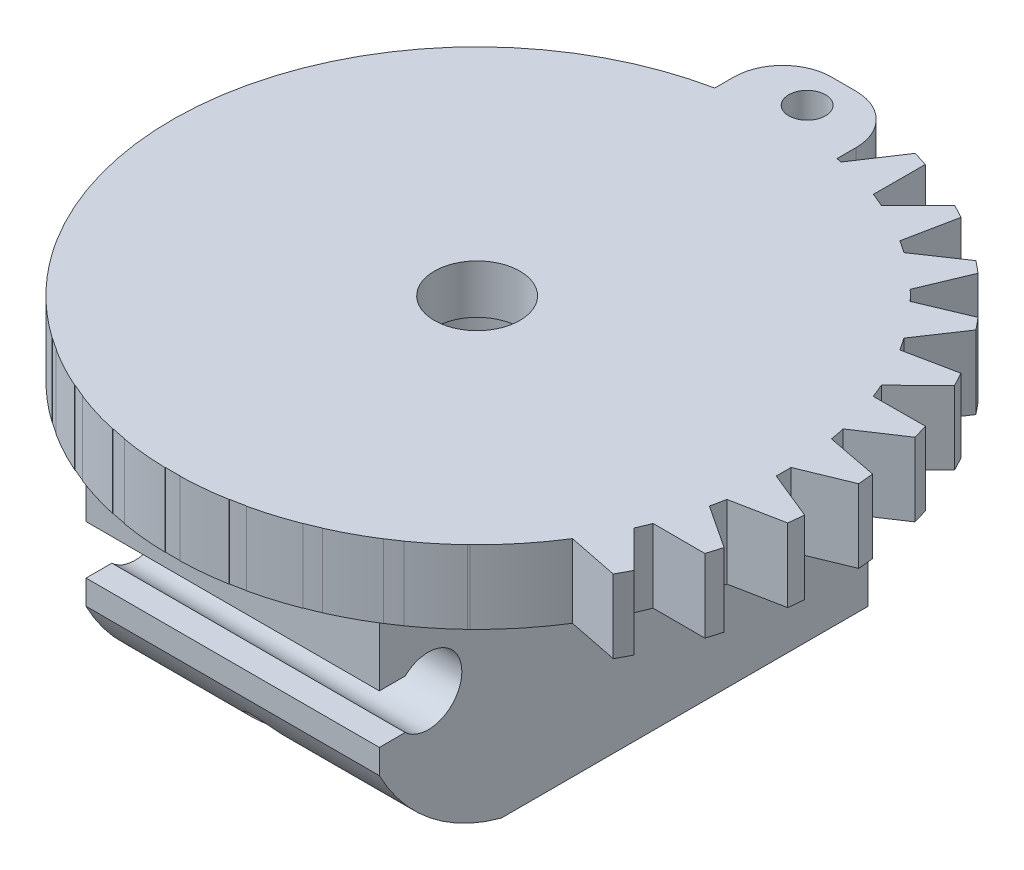
from build123d import *

# Parameters (mm, degrees)
SKETCH1_R                = 5.5
BOSS_EXTRUDE1_DEPTH      = 7
SKETCH2_R                = 3
CUT_EXTRUDE1_DEPTH       = 5
SKETCH3_R                = 10.5
BOSS_EXTRUDE2_DEPTH      = 3
BOSS_EXTRUDE3_DEPTH      = 3
SKETCH6_W                = 12
SKETCH6_H                = 20
BOSS_EXTRUDE4_DEPTH      = 10
CUT_EXTRUDE3_DEPTH       = 29.247125691
CUT_EXTRUDE3_DEPTH_BACK  = 29.247125691
CUT_EXTRUDE4_DEPTH       = 29.247125691
CUT_EXTRUDE4_DEPTH_BACK  = 29.247125691
CUT_EXTRUDE6_DEPTH       = 32.215381773
CUT_EXTRUDE6_DEPTH_BACK  = 32.215381773
SKETCH10_R               = 0.75
CUT_EXTRUDE9_DEPTH       = 10
SKETCH14_R               = 0.75
BOSS_EXTRUDE5_DEPTH      = 3
CUT_EXTRUDE10_DEPTH      = 29.881941521
CUT_EXTRUDE10_DEPTH_BACK = 7
SKETCH15_R               = 7.212432164
SKETCH16_R               = 3
SKETCH16_R_2             = 1.5
BOSS_EXTRUDE6_DEPTH      = 3
CUT_EXTRUDE2_DEPTH       = 24.112043268
CUT_EXTRUDE2_DEPTH_BACK  = 24.112043268
SKETCH5_R                = 3
BOSS_EXTRUDE7_START      = -2
SKETCH17_R               = 3
SKETCH17_R_2             = 1.75
BOSS_EXTRUDE7_DEPTH      = 2
SCALE1_SCALE             = 1.02


with BuildPart() as part:
    # Sketch1 → Boss-Extrude1 (new body)
    with BuildSketch(Plane(origin=(0, 0, 0), x_dir=(1, 0, 0), z_dir=(0, 1, 0))):
        with Locations(Location((0, 0, 0), (0, 0, 270))):
            Circle(SKETCH1_R)
    extrude(amount=BOSS_EXTRUDE1_DEPTH)

    # Sketch2 → Cut-Extrude1 (cut)
    with BuildSketch(Plane(origin=(0, 7, 0), x_dir=(1, 0, 0), z_dir=(0, 1, 0))):
        with Locations(Location((0, 0, 0), (0, 0, 270))):
            Circle(SKETCH2_R)
    extrude(amount=-CUT_EXTRUDE1_DEPTH, mode=Mode.SUBTRACT)

    # Sketch3 → Boss-Extrude2 (add)
    with BuildSketch(Plane.XZ):
        with Locations(Location((0, 0, 0), (0, 0, 270))):
            Circle(SKETCH3_R)
    extrude(amount=BOSS_EXTRUDE2_DEPTH)



with BuildPart() as body_2:
    # Sketch4 → Boss-Extrude3 (new body)
    with BuildSketch(Plane.XZ.offset(3)):
        with BuildLine():
            Line((2.736209331, 12.158039162), (3.910472421, 13.924200371))
            ThreePointArc((3.910472421, 13.924200371), (4.214262083, 13.835647145), (4.516047029, 13.740485809))
            Line((4.516047029, 13.740485809), (4.504601886, 11.622094636))
            ThreePointArc((4.504601886, 11.622094636), (4.785412065, 11.509822362), (5.063423964, 11.390789577))
            Line((5.063423964, 11.390789577), (6.559684877, 12.893927129))
            ThreePointArc((6.559684877, 12.893927129), (6.840361429, 12.747809005), (7.117782605, 12.595600846))
            Line((7.117782605, 12.595600846), (6.693279762, 10.520146802))
            ThreePointArc((6.693279762, 10.520146802), (6.946791018, 10.35524846), (7.196238852, 10.184265425))
            Line((7.196238852, 10.184265425), (8.95699712, 11.366614588))
            ThreePointArc((8.95699712, 11.366614588), (9.203774319, 11.168546804), (9.446170586, 10.965141094))
            Line((9.446170586, 10.965141094), (8.624923448, 9.012382714))
            ThreePointArc((8.624923448, 9.012382714), (8.841393486, 8.801195255), (9.052691114, 8.584832753))
            Line((9.052691114, 8.584832753), (11.010281785, 9.400956511))
            ThreePointArc((11.010281785, 9.400956511), (11.213676121, 9.158550701), (11.411732327, 8.911764209))
            Line((11.411732327, 8.911764209), (10.225300961, 7.156744902))
            ThreePointArc((10.225300961, 7.156744902), (10.396410958, 6.907384142), (10.561438332, 6.653956862))
            Line((10.561438332, 6.653956862), (12.640632293, 7.072492036))
            ThreePointArc((12.640632293, 7.072492036), (12.792827437, 6.795063719), (12.938932393, 6.514380312))
            Line((12.938932393, 6.514380312), (11.432910691, 5.024544486))
            ThreePointArc((11.432910691, 5.024544486), (11.552084986, 4.746593218), (11.664500196, 4.465840229))
            Line((11.664500196, 4.465840229), (13.78539519, 4.470702748))
            ThreePointArc((13.78539519, 4.470702748), (13.880542367, 4.168913338), (13.96908134, 3.865119521))
            Line((13.96908134, 3.865119521), (12.201344873, 2.697720732))
            ThreePointArc((12.201344873, 2.697720732), (12.264003665, 2.401860468), (12.319486656, 2.10457095))
            Line((12.319486656, 2.10457095), (14.400577879, 1.695573949))
            ThreePointArc((14.400577879, 1.695573949), (14.435020636, 1.381021045), (14.462591124, 1.065791444))
            Line((14.462591124, 1.065791444), (12.501073011, 0.265692172))
            ThreePointArc((12.501073011, 0.265692172), (12.504808358, -0.036707344), (12.501226952, -0.339108722))
            Line((12.501226952, -0.339108722), (14.462539233, -1.146247717))
            ThreePointArc((14.462539233, -1.146247717), (14.434953956, -1.461476024), (14.40049644, -1.776027312))
            Line((14.40049644, -1.776027312), (12.320576723, -2.1780797))
            ThreePointArc((12.320576723, -2.1780797), (12.265245077, -2.475397424), (12.202736904, -2.771289547))
            Line((12.202736904, -2.771289547), (13.968898114, -3.945552637))
            ThreePointArc((13.968898114, -3.945552637), (13.880344888, -4.2493423), (13.785183552, -4.551127245))
            Line((13.785183552, -4.551127245), (11.666792379, -4.539682102))
            ThreePointArc((11.666792379, -4.539682102), (11.554520105, -4.820492281), (11.435487319, -5.09850418))
            Line((11.435487319, -5.09850418), (12.938624872, -6.594765093))
            ThreePointArc((12.938624872, -6.594765093), (12.792506748, -6.875441645), (12.640298588, -7.152862822))
            Line((12.640298588, -7.152862822), (10.564844544, -6.728359978))
            ThreePointArc((10.564844544, -6.728359978), (10.399946202, -6.981871234), (10.228963168, -7.231319068))
            Line((10.228963168, -7.231319068), (11.41131233, -8.992077336))
            ThreePointArc((11.41131233, -8.992077336), (11.213244546, -9.238854535), (11.009838837, -9.481250803))
            Line((11.009838837, -9.481250803), (9.057080457, -8.660003665))
            ThreePointArc((9.057080457, -8.660003665), (8.845892998, -8.876473702), (8.629530496, -9.08777133))
            Line((8.629530496, -9.08777133), (9.445654254, -11.045362001))
            ThreePointArc((9.445654254, -11.045362001), (9.203248443, -11.248756338), (8.956461952, -11.446812543))
            Line((8.956461952, -11.446812543), (7.201442645, -10.260381178))
            ThreePointArc((7.201442645, -10.260381178), (6.952081884, -10.431491175), (6.698654605, -10.596518548))
            Line((6.698654605, -10.596518548), (7.117189779, -12.67571251))
            ThreePointArc((7.117189779, -12.67571251), (6.839761462, -12.827907654), (6.559078054, -12.974012609))
            Line((6.559078054, -12.974012609), (5.069242229, -11.467990907))
            ThreePointArc((5.069242229, -11.467990907), (4.791290961, -11.587165203), (4.510537972, -11.699580412))
            Line((4.510537972, -11.699580412), (4.515400491, -13.820475406))
            ThreePointArc((4.515400491, -13.820475406), (4.213611081, -13.915622583), (3.909817264, -14.004161557))
            Line((3.909817264, -14.004161557), (2.742418475, -12.236425089))
            ThreePointArc((2.742418475, -12.236425089), (2.446558211, -12.299083881), (2.149268693, -12.354566873))
            Line((2.149268693, -12.354566873), (1.740271692, -14.435658095))
            ThreePointArc((1.740271692, -14.435658095), (1.425718788, -14.470100853), (1.110489187, -14.497671341))
            Line((1.110489187, -14.497671341), (0.310389914, -12.536153228))
            ThreePointArc((0.310389914, -12.536153228), (0.007990399, -12.539888575), (-0.294410979, -12.536307168))
            Line((-0.294410979, -12.536307168), (-1.101549974, -14.497619449))
            ThreePointArc((-1.101549974, -14.497619449), (-1.416778281, -14.470034172), (-1.731329569, -14.435576656))
            Line((-1.731329569, -14.435576656), (-2.133381958, -12.355656939))
            ThreePointArc((-2.133381958, -12.355656939), (-2.430699682, -12.300325294), (-2.726591804, -12.237817121))
            Line((-2.726591804, -12.237817121), (-3.900854894, -14.00397833))
            ThreePointArc((-3.900854894, -14.00397833), (-4.204644557, -13.915425104), (-4.506429502, -13.820263768))
            Line((-4.506429502, -13.820263768), (-4.49498436, -11.701872595))
            ThreePointArc((-4.49498436, -11.701872595), (-4.775794538, -11.589600321), (-5.053806437, -11.470567535))
            Line((-5.053806437, -11.470567535), (-6.55006735, -12.973705088))
            ThreePointArc((-6.55006735, -12.973705088), (-6.830743903, -12.827586964), (-7.108165079, -12.675378805))
            Line((-7.108165079, -12.675378805), (-6.683662236, -10.599924761))
            ThreePointArc((-6.683662236, -10.599924761), (-6.937173491, -10.435026419), (-7.186621325, -10.264043384))
            Line((-7.186621325, -10.264043384), (-8.947379593, -11.446392547))
            ThreePointArc((-8.947379593, -11.446392547), (-9.194156792, -11.248324763), (-9.43655306, -11.044919053))
            Line((-9.43655306, -11.044919053), (-8.615305922, -9.092160673))
            ThreePointArc((-8.615305922, -9.092160673), (-8.831775959, -8.880973214), (-9.043073588, -8.664610712))
            Line((-9.043073588, -8.664610712), (-11.000664258, -9.48073447))
            ThreePointArc((-11.000664258, -9.48073447), (-11.204058595, -9.238328659), (-11.402114801, -8.991542168))
            Line((-11.402114801, -8.991542168), (-10.215683435, -7.236522861))
            ThreePointArc((-10.215683435, -7.236522861), (-10.386793432, -6.9871621), (-10.551820805, -6.733734821))
            Line((-10.551820805, -6.733734821), (-12.631014767, -7.152269995))
            ThreePointArc((-12.631014767, -7.152269995), (-12.783209911, -6.874841678), (-12.929314866, -6.594158271))
            Line((-12.929314866, -6.594158271), (-11.423293165, -5.104322445))
            ThreePointArc((-11.423293165, -5.104322445), (-11.54246746, -4.826371177), (-11.654882669, -4.545618188))
            Line((-11.654882669, -4.545618188), (-13.775777664, -4.550480707))
            ThreePointArc((-13.775777664, -4.550480707), (-13.870924841, -4.248691297), (-13.959463814, -3.94489748))
            Line((-13.959463814, -3.94489748), (-12.191727346, -2.777498691))
            ThreePointArc((-12.191727346, -2.777498691), (-12.254386138, -2.481638427), (-12.30986913, -2.184348909))
            Line((-12.30986913, -2.184348909), (-14.390960352, -1.775351908))
            ThreePointArc((-14.390960352, -1.775351908), (-14.42540311, -1.460799004), (-14.452973598, -1.145569403))
            Line((-14.452973598, -1.145569403), (-12.491455485, -0.345470131))
            ThreePointArc((-12.491455485, -0.345470131), (-12.495190832, -0.043070615), (-12.491609425, 0.259330763))
            Line((-12.491609425, 0.259330763), (-14.452921707, 1.066469758))
            ThreePointArc((-14.452921707, 1.066469758), (-14.425336429, 1.381698065), (-14.390878914, 1.696249353))
            Line((-14.390878914, 1.696249353), (-12.310959197, 2.098301742))
            ThreePointArc((-12.310959197, 2.098301742), (-12.255627551, 2.395619466), (-12.193119378, 2.691511588))
            Line((-12.193119378, 2.691511588), (-13.959280588, 3.865774678))
            ThreePointArc((-13.959280588, 3.865774678), (-13.870727361, 4.169564341), (-13.775566025, 4.471349286))
            Line((-13.775566025, 4.471349286), (-11.657174852, 4.459904144))
            ThreePointArc((-11.657174852, 4.459904144), (-11.544902578, 4.740714322), (-11.425869793, 5.018726221))
            Line((-11.425869793, 5.018726221), (-12.929007346, 6.514987134))
            ThreePointArc((-12.929007346, 6.514987134), (-12.782889222, 6.795663686), (-12.630681062, 7.073084863))
            Line((-12.630681062, 7.073084863), (-10.555227018, 6.648582019))
            ThreePointArc((-10.555227018, 6.648582019), (-10.390328676, 6.902093275), (-10.219345641, 7.151541109))
            Line((-10.219345641, 7.151541109), (-11.401694804, 8.912299377))
            ThreePointArc((-11.401694804, 8.912299377), (-11.20362702, 9.159076576), (-11.000221311, 9.401472844))
            Line((-11.000221311, 9.401472844), (-9.04746293, 8.580225706))
            ThreePointArc((-9.04746293, 8.580225706), (-8.836275471, 8.796695743), (-8.619912969, 9.007993371))
            Line((-8.619912969, 9.007993371), (-9.436036727, 10.965584042))
            ThreePointArc((-9.436036727, 10.965584042), (-9.193630917, 11.168978379), (-8.946844425, 11.367034585))
            Line((-8.946844425, 11.367034585), (-7.191825118, 10.180603219))
            ThreePointArc((-7.191825118, 10.180603219), (-6.942464358, 10.351713216), (-6.689037078, 10.516740589))
            Line((-6.689037078, 10.516740589), (-7.107572253, 12.595934551))
            ThreePointArc((-7.107572253, 12.595934551), (-6.830143935, 12.748129695), (-6.549460528, 12.89423465))
            Line((-6.549460528, 12.89423465), (-5.059624702, 11.388212948))
            ThreePointArc((-5.059624702, 11.388212948), (-4.781673434, 11.507387244), (-4.500920446, 11.619802453))
            Line((-4.500920446, 11.619802453), (-4.505782964, 13.740697447))
            ThreePointArc((-4.505782964, 13.740697447), (-4.203993555, 13.835844625), (-3.900199737, 13.924383598))
            Line((-3.900199737, 13.924383598), (-2.732800948, 12.15664713))
            ThreePointArc((-2.732800948, 12.15664713), (-2.436940684, 12.219305922), (-2.139651166, 12.274788914))
            Line((-2.139651166, 12.274788914), (-1.730654165, 14.355880136))
            ThreePointArc((-1.730654165, 14.355880136), (-1.416101261, 14.390322894), (-1.10087166, 14.417893382))
            Line((-1.10087166, 14.417893382), (-0.300772388, 12.456375269))
            ThreePointArc((-0.300772388, 12.456375269), (0.001627128, 12.460110616), (0.304028506, 12.456529209))
            Line((0.304028506, 12.456529209), (1.1111675, 14.417841491))
            ThreePointArc((1.1111675, 14.417841491), (1.426395808, 14.390256213), (1.740947096, 14.355798697))
            Line((1.740947096, 14.355798697), (2.142999484, 12.27587898))
            ThreePointArc((2.142999484, 12.27587898), (2.440317208, 12.220547335), (2.736209331, 12.158039162))
        make_face()
    extrude(amount=-BOSS_EXTRUDE3_DEPTH)


with BuildPart() as part_1:
    add(part.part)

    add(body_2.part)  # Boss-Extrude4 merges body 2
    # Sketch6 → Boss-Extrude4 (add)
    with BuildSketch(Plane.XZ.offset(3)):
        Rectangle(SKETCH6_W, SKETCH6_H)
    extrude(amount=BOSS_EXTRUDE4_DEPTH)

    # Sketch7 → Cut-Extrude3 (cut, two sides: drawn at the far end of the back side and taken through both)
    with BuildSketch(Plane.ZY.offset(6).offset(-CUT_EXTRUDE3_DEPTH_BACK)):
        with BuildLine():
            Line((8, -8), (8, -7))
            Line((8, -7), (8, -6))
            Line((8, -6), (8.943729304, -6))
            ThreePointArc((8.943729304, -6), (6.625, -7), (8.943729304, -8))
            Line((8.943729304, -8), (8, -8))
        make_face()
        with BuildLine():
            Line((9.375, -7), (8, -7))
            Line((8, -7), (8, -8))
            Line((8, -8), (8.943729304, -8))
            ThreePointArc((8.943729304, -8), (9.262587184, -7.544516853), (9.375, -7))
        make_face()
        with BuildLine():
            Line((8, -6), (8, -7))
            Line((8, -7), (9.375, -7))
            ThreePointArc((9.375, -7), (9.262587184, -6.455483147), (8.943729304, -6))
            Line((8.943729304, -6), (8, -6))
        make_face()
        with BuildLine():
            Line((10, -7), (9.375, -7))
            ThreePointArc((9.375, -7), (9.262587184, -7.544516853), (8.943729304, -8))
            Line((8.943729304, -8), (10, -8))
            Line((10, -8), (10, -7))
        make_face()
        with BuildLine():
            ThreePointArc((8.943729304, -6), (9.262587184, -6.455483147), (9.375, -7))
            Line((9.375, -7), (10, -7))
            Line((10, -7), (10, -6))
            Line((10, -6), (8.943729304, -6))
        make_face()
    extrude(amount=CUT_EXTRUDE3_DEPTH + CUT_EXTRUDE3_DEPTH_BACK, mode=Mode.SUBTRACT)

    # Sketch8 → Cut-Extrude4 (cut, two sides: drawn at the far end of the back side and taken through both)
    with BuildSketch(Plane.ZY.offset(6).offset(-CUT_EXTRUDE4_DEPTH_BACK)):
        with BuildLine():
            Line((10, -9), (10, -13))
            Line((10, -13), (5, -13))
            ThreePointArc((5, -13), (7.927069529, -11.533836911), (10, -9))
        make_face()
    extrude(amount=CUT_EXTRUDE4_DEPTH + CUT_EXTRUDE4_DEPTH_BACK, mode=Mode.SUBTRACT)

    # Sketch10 → Cut-Extrude6 (cut, two sides: drawn at the far end of the back side and taken through both)
    with BuildSketch(Plane(origin=(0, 0, -10), x_dir=(-1, 0, 0), z_dir=(0, 0, -1)).offset(-CUT_EXTRUDE6_DEPTH_BACK)):
        with Locations((0, -11)):
            Circle(SKETCH10_R)
    extrude(amount=CUT_EXTRUDE6_DEPTH + CUT_EXTRUDE6_DEPTH_BACK, mode=Mode.SUBTRACT)

    # Sketch12 → Cut-Extrude9 (cut)
    with BuildSketch(Plane.XZ.offset(3)):
        with BuildLine():
            Line((10.555227018, 6.648582019), (12.641783232, 8.735138233))
            ThreePointArc((12.641783232, 8.735138233), (-14.30689288, 5.606258944), (3.341641779, -14.998358358))
            Line((3.341641779, -14.998358358), (2.712837204, -12.17608207))
            ThreePointArc((2.712837204, -12.17608207), (-11.515310528, 4.797299626), (10.555227018, 6.648582019))
        make_face()
    extrude(amount=-CUT_EXTRUDE9_DEPTH, mode=Mode.SUBTRACT)

    # Sketch14 → Boss-Extrude5 (add)
    with BuildSketch(Plane.XZ.offset(3)):
        with BuildLine():
            Line((-2.5, 0), (2.5, 0))
            Line((2.5, 0), (2.5, -13))
            ThreePointArc((2.5, -13), (1.914213562, -14.414213562), (0.5, -15))
            Line((0.5, -15), (-0.5, -15))
            ThreePointArc((-0.5, -15), (-1.914213562, -14.414213562), (-2.5, -13))
            Line((-2.5, -13), (-2.5, 0))
        make_face()
        with Locations(Location((0, -13.5, 0), (0, 0, 270))):
            Circle(SKETCH14_R, mode=Mode.SUBTRACT)
    extrude(amount=-BOSS_EXTRUDE5_DEPTH)

    # Sketch15 → Cut-Extrude10 (cut, two sides: drawn at the far end of the back side and taken through both)
    with BuildSketch(Plane(origin=(0, 7, 0), x_dir=(1, 0, 0), z_dir=(0, 1, 0)).offset(-CUT_EXTRUDE10_DEPTH_BACK)):
        Circle(SKETCH15_R)
    extrude(amount=CUT_EXTRUDE10_DEPTH + CUT_EXTRUDE10_DEPTH_BACK, mode=Mode.SUBTRACT)

    # Sketch16 → Boss-Extrude6 (add)
    with BuildSketch(Plane(origin=(0, 0, 0), x_dir=(1, 0, 0), z_dir=(0, 1, 0))):
        with Locations(Location((0, 0, 0), (0, 0, 90))):
            Circle(SKETCH16_R)
        with Locations(Location((0, 0, 0), (0, 0, 270))):
            Circle(SKETCH16_R_2, mode=Mode.SUBTRACT)
    extrude(amount=BOSS_EXTRUDE6_DEPTH)

    # Sketch5 → Cut-Extrude2 (cut, two sides: drawn at the far end of the back side and taken through both)
    with BuildSketch(Plane.XZ.offset(3).offset(-CUT_EXTRUDE2_DEPTH_BACK)):
        with Locations(Location((0, 0, 0), (0, 0, 270))):
            Circle(SKETCH5_R)
    extrude(amount=CUT_EXTRUDE2_DEPTH + CUT_EXTRUDE2_DEPTH_BACK, mode=Mode.SUBTRACT)

    # Sketch17 → Boss-Extrude7 (add)
    with BuildSketch(Plane(origin=(0, 0, 0), x_dir=(1, 0, 0), z_dir=(0, 1, 0)).offset(BOSS_EXTRUDE7_START)):
        with Locations(Location((0, 0, 0), (0, 0, 90))):
            Circle(SKETCH17_R)
        with Locations(Location((0, 0, 0), (0, 0, 270))):
            Circle(SKETCH17_R_2, mode=Mode.SUBTRACT)
    extrude(amount=BOSS_EXTRUDE7_DEPTH)


with BuildPart() as part_2:
    # Scale1: scaled about (0.233418043, -5.029987814, -0.634212354)
    add(part_1.part.scale(SCALE1_SCALE).moved(Location((-0.004668361, 0.100599756, 0.012684247))))


solid = part_2.part
